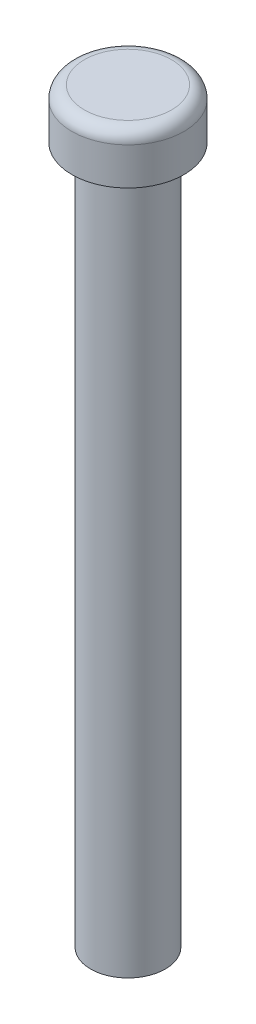
from build123d import *

# Parameters (mm, degrees)
SKETCH1_R           = 1.5
BOSS_EXTRUDE1_DEPTH = 28
SKETCH2_R           = 2.25
BOSS_EXTRUDE2_DEPTH = 2
FILLET1_R           = 0.5


with BuildPart() as part:
    # Sketch1 → Boss-Extrude1 (new body)
    with BuildSketch(Plane(origin=(0, 0, 0), x_dir=(1, 0, 0), z_dir=(0, 1, 0))):
        with Locations(Location((0, 0, 0), (0, 0, 270))):
            Circle(SKETCH1_R)
    extrude(amount=BOSS_EXTRUDE1_DEPTH)

    # Sketch2 → Boss-Extrude2 (add)
    with BuildSketch(Plane(origin=(0, 28, 0), x_dir=(1, 0, 0), z_dir=(0, 1, 0))):
        with Locations(Location((0, 0, 0), (0, 0, 270))):
            Circle(SKETCH2_R)
    extrude(amount=BOSS_EXTRUDE2_DEPTH)

    # Fillet1
    fillet1_edges = [part.edges().sort_by_distance(p)[0] for p in [
        (0, 30, -2.25),
    ]]
    fillet(fillet1_edges, radius=FILLET1_R)


solid = part.part
